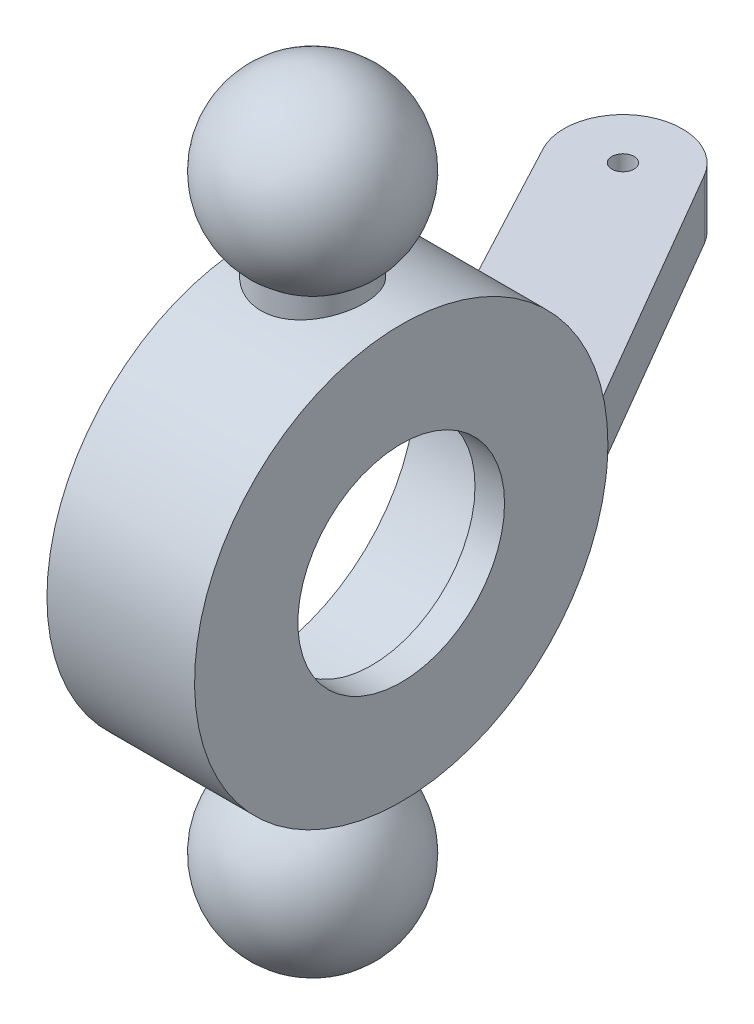
from build123d import *

# Parameters (mm, degrees)
SKETCH1_R                = 14
SKETCH1_R_2              = 11
BOSS_EXTRUDE1_DEPTH      = 8
SKETCH2_W                = 3.5
SKETCH2_H                = 8
SKETCH4_R                = 14
SKETCH4_R_2              = 7
BOSS_EXTRUDE2_DEPTH      = 2
BOSS_EXTRUDE3_DEPTH      = 2
BOSS_EXTRUDE3_DEPTH_BACK = 2
SKETCH5_R                = 0.75


with BuildPart() as part:
    # Sketch1 → Boss-Extrude1 (new body)
    with BuildSketch(Plane(origin=(0, 0, 0), x_dir=(0, 0, -1), z_dir=(1, 0, 0))):
        Circle(SKETCH1_R)
        Circle(SKETCH1_R_2, mode=Mode.SUBTRACT)
    extrude(amount=BOSS_EXTRUDE1_DEPTH)

    # Sketch2 → Revolve1 (revolve)
    with BuildSketch(Plane(origin=(4, 0, 0), x_dir=(0, 0, -1), z_dir=(1, 0, 0))):
        with Locations((1.75, 16)):
            Rectangle(SKETCH2_W, SKETCH2_H)
    revolve1 = revolve(axis=Axis((4, 12, 0), (0, 1, 0)))

    # Sketch3 → Revolve2 (revolve)
    with BuildSketch(Plane(origin=(4, 0, 0), x_dir=(0, 0, -1), z_dir=(1, 0, 0))):
        with BuildLine():
            Line((0, 26), (0, 14))
            ThreePointArc((0, 14), (6, 20), (0, 26))
        make_face()
    revolve2 = revolve(axis=Axis((4, 14, 0), (0, 1, 0)))

    # Mirror1: Revolve1, Revolve2 across plane
    add(revolve1.mirror(Plane.ZX))
    add(revolve2.mirror(Plane.ZX))

    # Sketch4 → Boss-Extrude2 (add)
    with BuildSketch(Plane(origin=(8, 0, 0), x_dir=(0, 0, -1), z_dir=(1, 0, 0))):
        Circle(SKETCH4_R)
        Circle(SKETCH4_R_2, mode=Mode.SUBTRACT)
    extrude(amount=BOSS_EXTRUDE2_DEPTH)

    # Sketch5 → Boss-Extrude3 (add, two sides: drawn at the far end of the back side and taken through both)
    with BuildSketch(Plane(origin=(0, 0, 0), x_dir=(1, 0, 0), z_dir=(0, 1, 0)).offset(-BOSS_EXTRUDE3_DEPTH_BACK)):
        with BuildLine():
            Line((10, 13), (0, 13))
            Line((0, 13), (-7.508861075, 27.122113749))
            ThreePointArc((-7.508861075, 27.122113749), (-7.405739907, 31.0601523), (-3.977070704, 33))
            Line((-3.977070704, 33), (-3.934896023, 33))
            ThreePointArc((-3.934896023, 33), (-1.940550712, 32.467360203), (-0.477339242, 31.01129339))
            Line((-0.477339242, 31.01129339), (10, 13))
        make_face()
        with Locations((-3.977070704, 29)):
            Circle(SKETCH5_R, mode=Mode.SUBTRACT)
    extrude(amount=BOSS_EXTRUDE3_DEPTH + BOSS_EXTRUDE3_DEPTH_BACK)


solid = part.part
